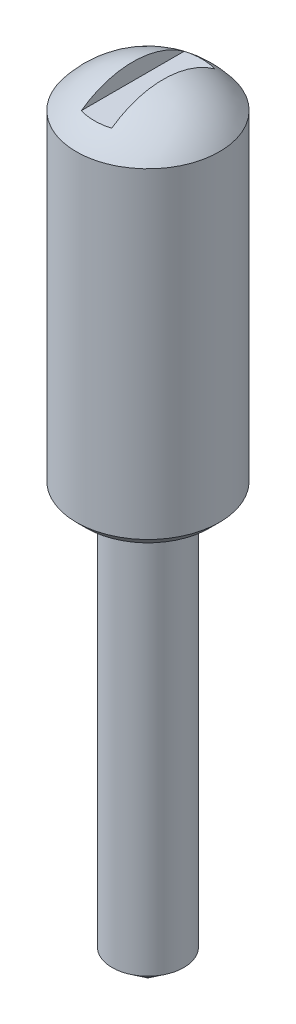
from build123d import *

# Parameters (mm, degrees)
DOME_1_FACE_RADIUS       = 4
DOME_1_HEIGHT            = 2
CUT_EXTRUDE_1_DEPTH      = 45.362146026
CUT_EXTRUDE_1_DEPTH_BACK = 45.362146026
SKETCH_3_W               = 1.7
SKETCH_3_H               = 10
CHAMFER_1_SIZE           = 0.5545


with BuildPart() as part:
    # Эскиз2 → Повернуть1 (revolve)
    with BuildSketch(Plane.XY, mode=Mode.PRIVATE) as revolve_1_sk:
        Polygon((0, 0), (2, 1.5), (2, 23.5), (4, 23.5), (4, 42), (0, 42), align=None)
    revolve(revolve_1_sk.sketch.rotate(Axis((0, 42, 0), (0, -1, 0)), 90), axis=Axis((0, 42, 0), (0, -1, 0)))

    # Купол1: a dome of height H over a round flat face of radius A is a cap of a sphere of radius (A * A + H * H) / (2 * H)
    dome_1_r = (DOME_1_FACE_RADIUS * DOME_1_FACE_RADIUS + DOME_1_HEIGHT * DOME_1_HEIGHT) / (2 * DOME_1_HEIGHT)
    dome_1_base = Plane((0, 42, 0), z_dir=(0, 1, 0))
    with Locations(dome_1_base.offset(DOME_1_HEIGHT - dome_1_r)):
        dome_1_ball = Sphere(dome_1_r, mode=Mode.PRIVATE)
    add(split(dome_1_ball, bisect_by=dome_1_base, keep=Keep.TOP, mode=Mode.PRIVATE))

    # Эскиз3 → Вырез-Вытянуть1 (cut, two sides: drawn at the far end of the back side and taken through both)
    with BuildSketch(Plane.XY.offset(-CUT_EXTRUDE_1_DEPTH_BACK)):
        with Locations((0, 48)):
            Rectangle(SKETCH_3_W, SKETCH_3_H)
    extrude(amount=CUT_EXTRUDE_1_DEPTH + CUT_EXTRUDE_1_DEPTH_BACK, mode=Mode.SUBTRACT)

    # Фаска1
    chamfer_1_edges = [part.edges().sort_by_distance(p)[0] for p in [
        (0, 23.5, -4),
    ]]
    chamfer(chamfer_1_edges, length=CHAMFER_1_SIZE)


solid = part.part
